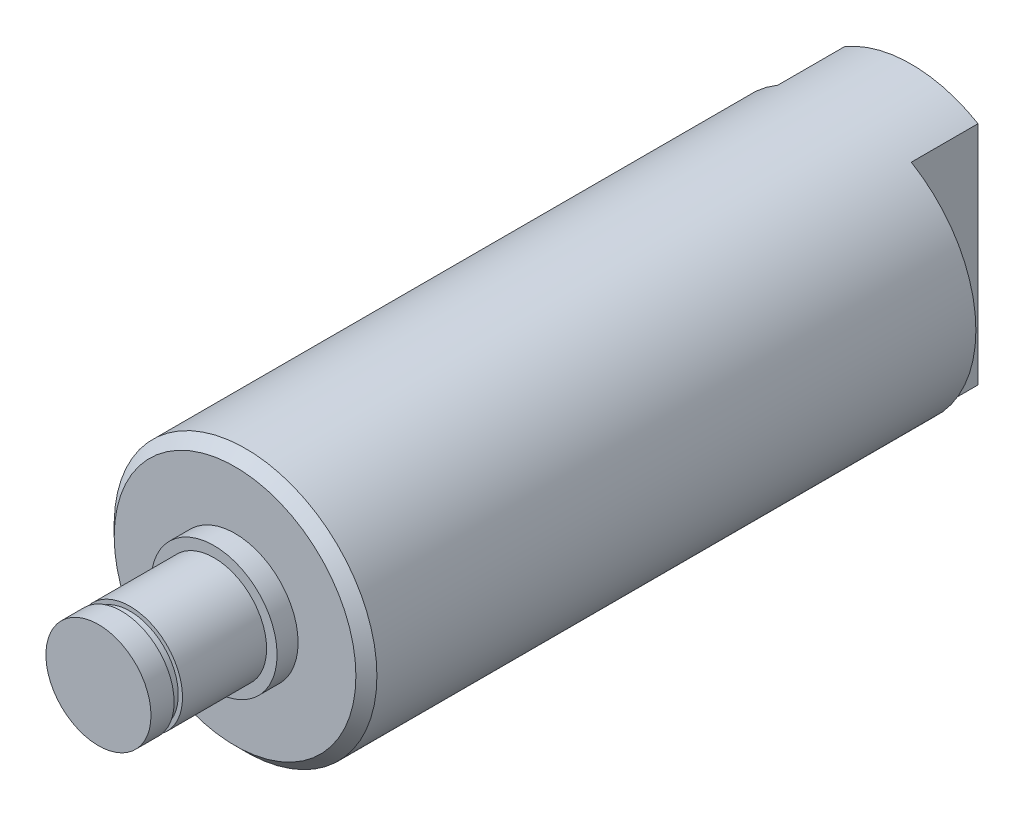
from build123d import *
from build123d.topology import SkipClean

# Parameters (mm, degrees)
CROQUIS1_R                      = 6.35
SALIENTE_EXTRUIR1_DEPTH         = 6.35
CROQUIS2_R                      = 12.5
SALIENTE_EXTRUIR2_DEPTH         = 58
CROQUIS3_R                      = 6
SALIENTE_EXTRUIR3_DEPTH         = 2
CROQUIS4_R                      = 5
SALIENTE_EXTRUIR4_DEPTH         = 11
SALIENTE_EXTRUIR5_START         = 6.35
SALIENTE_EXTRUIR5_DEPTH         = 6.35
CROQUIS7_W                      = 0.8
CROQUIS7_H                      = 0.8
CHAFL_N1_SIZE                   = 1
TALADRO_ROSCADO_M10X1_251_D     = 8.8
TALADRO_ROSCADO_M10X1_251_DEPTH = 25
TALADRO_ROSCADO_M10X1_251_TIP   = 2.643786724


with BuildPart() as part:
    # Croquis1 → Saliente-Extruir1 (new body)
    with BuildSketch(Plane.XY):
        Circle(CROQUIS1_R)
    extrude(amount=SALIENTE_EXTRUIR1_DEPTH)

    # Croquis2 → Saliente-Extruir2 (add)
    with BuildSketch(Plane.XY.offset(6.35)):
        with Locations(Location((0, 0, 0), (0, 0, 180))):
            Circle(CROQUIS2_R)
    extrude(amount=SALIENTE_EXTRUIR2_DEPTH)

    # Croquis3 → Saliente-Extruir3 (add)
    with BuildSketch(Plane.XY.offset(64.35)):
        Circle(CROQUIS3_R)
    extrude(amount=SALIENTE_EXTRUIR3_DEPTH)

    # Croquis4 → Saliente-Extruir4 (add)
    with BuildSketch(Plane.XY.offset(66.35)):
        Circle(CROQUIS4_R)
    extrude(amount=SALIENTE_EXTRUIR4_DEPTH)

    # Croquis6 → Saliente-Extruir5 (add)
    with SkipClean():  # the faces are left unmerged after this step: merging them gives an invalid solid
        with BuildSketch(Plane(origin=(0, 0, 6.35), x_dir=(-1, 0, 0), z_dir=(0, 0, -1)).offset(SALIENTE_EXTRUIR5_START)):
            with BuildLine():
                Line((-6.35, 10.76696336), (-6.35, -10.76696336))
                ThreePointArc((-6.35, -10.76696336), (0, -12.5), (6.35, -10.76696336))
                Line((6.35, -10.76696336), (6.35, 10.76696336))
                ThreePointArc((6.35, 10.76696336), (0, 12.5), (-6.35, 10.76696336))
            make_face()
        extrude(amount=-SALIENTE_EXTRUIR5_DEPTH)

    # Croquis7 → Cortar-Revolución1 (revolve, cut)
    with SkipClean():  # the faces are left unmerged after this step: merging them gives an invalid solid
        with BuildSketch(Plane(origin=(0, 0, 0), x_dir=(0, 0, -1), z_dir=(1, 0, 0)), mode=Mode.PRIVATE) as cortar_revoluci_n1_sk:
            with Locations((-74.75, 5)):
                Rectangle(CROQUIS7_W, CROQUIS7_H)
        revolve(cortar_revoluci_n1_sk.sketch.rotate(Axis((0, 0, 66.35), (0, 0, 1)), 90), axis=Axis((0, 0, 66.35), (0, 0, 1)), mode=Mode.SUBTRACT)

    # Chaflán1
    chafl_n1_edges = [part.edges().sort_by_distance(p)[0] for p in [
        (12.5, 0, 64.35),
    ]]
    chamfer(chafl_n1_edges, length=CHAFL_N1_SIZE)

    # Taladro roscado M10x1.251
    with Locations(Plane(origin=(0, 0, 0), x_dir=(-1, 0, 0), z_dir=(0, 0, -1))):
        with Locations((0, 0)):
            Hole(TALADRO_ROSCADO_M10X1_251_D / 2, depth=TALADRO_ROSCADO_M10X1_251_DEPTH)
            with Locations((0, 0, -(TALADRO_ROSCADO_M10X1_251_DEPTH + TALADRO_ROSCADO_M10X1_251_TIP / 2))):  # 118° drill point
                Cone(0, TALADRO_ROSCADO_M10X1_251_D / 2, TALADRO_ROSCADO_M10X1_251_TIP, mode=Mode.SUBTRACT)


solid = part.part
